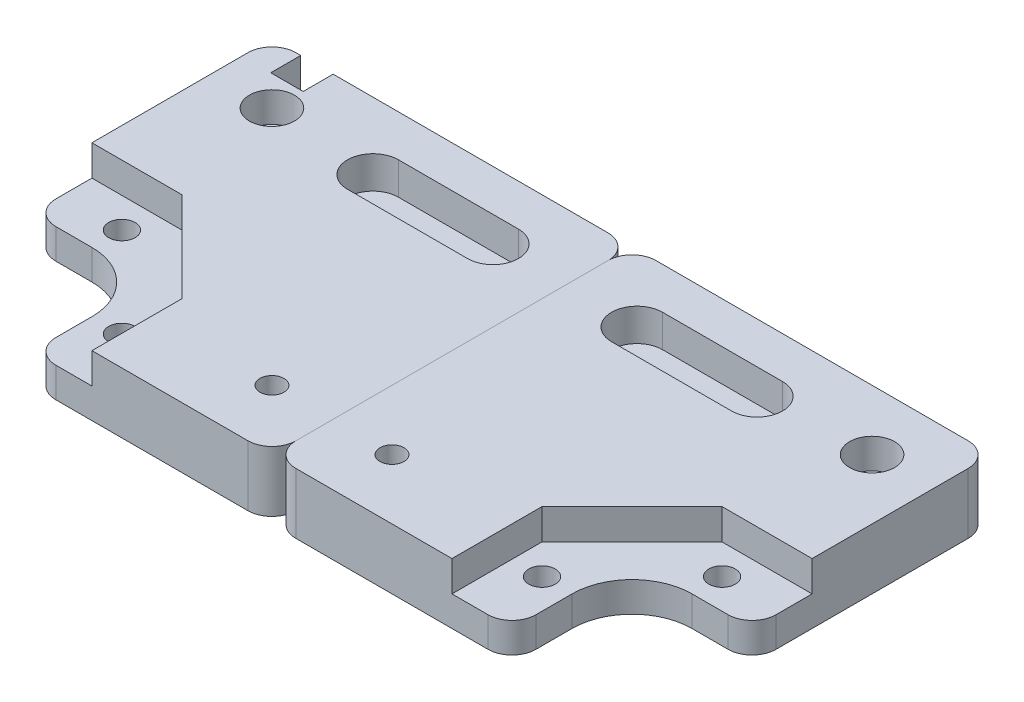
from build123d import *

# Parameters (mm, degrees)
SKETCH1_R           = 2.2
BOSS_EXTRUDE1_DEPTH = 10.1
CUT_EXTRUDE2_DEPTH  = 5.4
CUT_EXTRUDE4_DEPTH  = 5.1
SKETCH9_R           = 2
CUT_EXTRUDE5_DEPTH  = 73.814902321
SKETCH10_R          = 3.75
CUT_EXTRUDE6_DEPTH  = 5
FILLET2_R           = 10
FILLET3_R           = 4
CUT_EXTRUDE7_DEPTH  = 5


with BuildPart() as part:
    # Sketch1 → Boss-Extrude1 (new body)
    with BuildSketch(Plane(origin=(0, 0, 0), x_dir=(1, 0, 0), z_dir=(0, 1, 0))):
        Polygon((0, 0), (0, 20), (20, 20), (20, 60), (-40, 60), (-40, 0), align=None)
        with Locations(Location((10, 25, 0), (0, 0, 270))):
            Circle(SKETCH1_R, mode=Mode.SUBTRACT)
        with Locations(Location((-5, 10, 0), (0, 0, 90))):
            Circle(SKETCH1_R, mode=Mode.SUBTRACT)
    extrude(amount=BOSS_EXTRUDE1_DEPTH)

    # Sketch4 → Cut-Extrude2 (cut)
    with BuildSketch(Plane(origin=(0, 10.1, 0), x_dir=(1, 0, 0), z_dir=(0, 1, 0))):
        with BuildLine():
            Line((-28, 53.083248844), (-8, 53.083248844))
            ThreePointArc((-8, 53.083248844), (-3.75, 48.833248844), (-8, 44.583248844))
            Line((-8, 44.583248844), (-28, 44.583248844))
            ThreePointArc((-28, 44.583248844), (-32.25, 48.833248844), (-28, 53.083248844))
        make_face()
    extrude(amount=-CUT_EXTRUDE2_DEPTH, mode=Mode.SUBTRACT)

    # Sketch7 → Cut-Extrude4 (cut)
    with BuildSketch(Plane(origin=(0, 10.1, 0), x_dir=(1, 0, 0), z_dir=(0, 1, 0))):
        Polygon((20, 0), (-10, 0), (-10, 15), (5, 30), (20, 30), align=None)
    extrude(amount=-CUT_EXTRUDE4_DEPTH, mode=Mode.SUBTRACT)

    # Sketch9 → Cut-Extrude5 (cut, through all)
    with BuildSketch(Plane(origin=(0, 10.1, 0), x_dir=(1, 0, 0), z_dir=(0, 1, 0))):
        with Locations(Location((-30, 10, 0), (0, 0, 270))):
            Circle(SKETCH9_R)
        with Locations(Location((10, 50, 0), (0, 0, 90))):
            Circle(SKETCH9_R)
    extrude(amount=-CUT_EXTRUDE5_DEPTH, mode=Mode.SUBTRACT)

    # Sketch10 → Cut-Extrude6 (cut)
    with BuildSketch(Plane(origin=(0, 10.1, 0), x_dir=(1, 0, 0), z_dir=(0, 1, 0))):
        with Locations(Location((10, 50, 0), (0, 0, 270))):
            Circle(SKETCH10_R)
    extrude(amount=-CUT_EXTRUDE6_DEPTH, mode=Mode.SUBTRACT)

    # Fillet2
    fillet2_edges = [part.edges().sort_by_distance(p)[0] for p in [
        (0, 2.5, -20),
    ]]
    fillet(fillet2_edges, radius=FILLET2_R)

    # Fillet3
    fillet3_edges = [part.edges().sort_by_distance(p)[0] for p in [
        (-40, 5.05, -60),
        (20, 5.05, -60),
        (-40, 5.05, 0),
        (20, 2.5, -20),
        (0, 2.5, 0),
    ]]
    fillet(fillet3_edges, radius=FILLET3_R)


with BuildPart() as body_2:
    # Mirror1: mirrored copy
    add(part.part.mirror(Plane(origin=(-40, 10.1, 0), x_dir=(0, 0, 1), z_dir=(1, 0, 0))))

    # Sketch11 → Cut-Extrude7 (cut)
    with BuildSketch(Plane(origin=(0, 0, -60), x_dir=(-1, 0, 0), z_dir=(0, 0, -1))):
        Polygon((96, 1.8), (89, 1.8), (89, 5), (89.8, 5), (89.8, 10.1), (95.2, 10.1), (95.2, 5), (96, 5), align=None)
    extrude(amount=-CUT_EXTRUDE7_DEPTH, mode=Mode.SUBTRACT)


solid = Compound([part.part, body_2.part])
